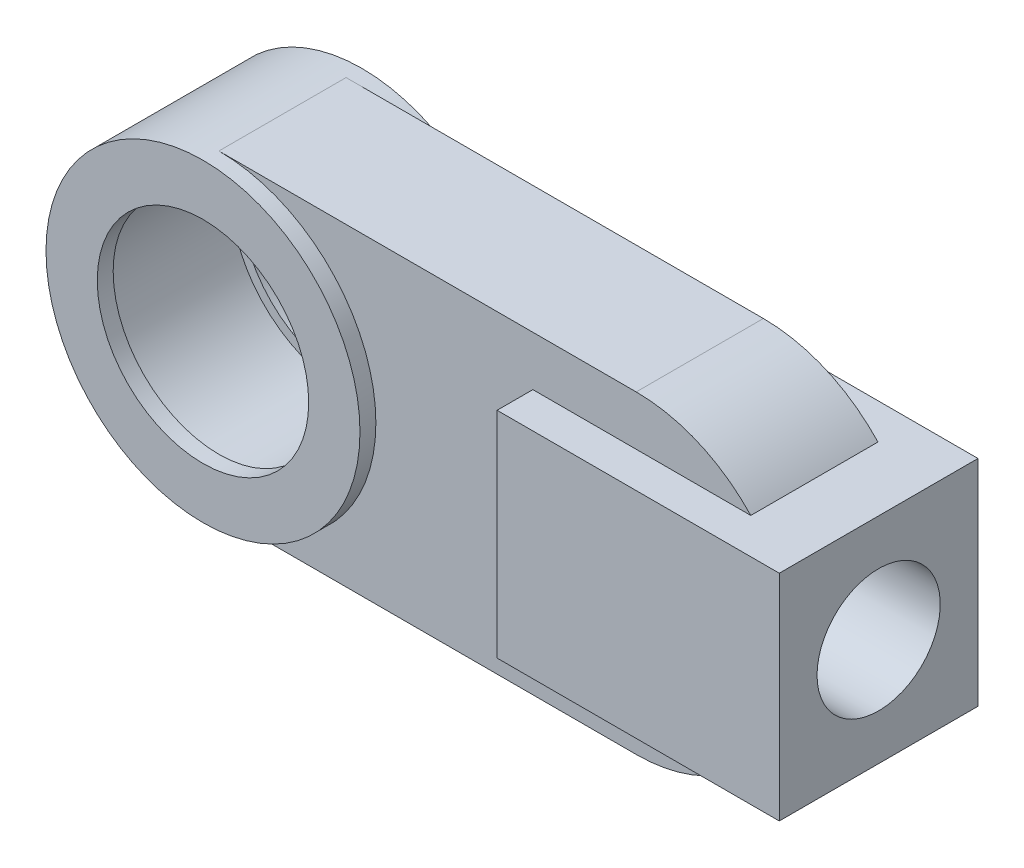
from build123d import *

# Parameters (mm, degrees)
F_01_START                              = -1.6
F_01_SOCKET_HEAD_AND_SHANK_DEPTH        = 3.2
F_02_START                              = -2
S02_ARTICULATION_OPENING_R              = 2.9
F_02_ARTICULATION_OPENING_DEPTH         = 4
F_03_START                              = -2
S03_CAPTIVE_SPHERICAL_SEAT_LIP_1_R      = 3.95
S03_CAPTIVE_SPHERICAL_SEAT_LIP_1_R_2    = 2.66
F_03_CAPTIVE_SPHERICAL_SEAT_LIP_1_DEPTH = 0.4
F_04_START                              = 1.6
S04_CAPTIVE_SPHERICAL_SEAT_LIP_2_R      = 3.95
S04_CAPTIVE_SPHERICAL_SEAT_LIP_2_R_2    = 2.66
F_04_CAPTIVE_SPHERICAL_SEAT_LIP_2_DEPTH = 0.4
F_05_START                              = -2.5
S05_ROD_THREAD_BOSS_W                   = 7.1
S05_ROD_THREAD_BOSS_H                   = 5.4
F_05_ROD_THREAD_BOSS_DEPTH              = 5
F_06_START                              = 7
S06_M3_INTERNAL_THREAD_ENVELOPE_R       = 1.55
F_06_M3_INTERNAL_THREAD_ENVELOPE_DEPTH  = 9


with BuildPart() as part:
    # S01 - Socket head and shank → 01 - Socket head and shank (new body)
    with BuildSketch(Plane.XY.offset(F_01_START)):
        with BuildLine():
            Line((0, 3.95), (10.5, 3.95))
            ThreePointArc((10.5, 3.95), (14.45, 0), (10.5, -3.95))
            Line((10.5, -3.95), (0, -3.95))
            ThreePointArc((0, -3.95), (-3.95, 0), (0, 3.95))
        make_face()
    extrude(amount=F_01_SOCKET_HEAD_AND_SHANK_DEPTH)

    # S02 - Articulation opening → 02 - Articulation opening (cut)
    with BuildSketch(Plane.XY.offset(F_02_START)):
        Circle(S02_ARTICULATION_OPENING_R)
    extrude(amount=F_02_ARTICULATION_OPENING_DEPTH, mode=Mode.SUBTRACT)

    # S03 - Captive spherical seat lip 1 → 03 - Captive spherical seat lip 1 (add)
    with BuildSketch(Plane.XY.offset(F_03_START)):
        Circle(S03_CAPTIVE_SPHERICAL_SEAT_LIP_1_R)
        Circle(S03_CAPTIVE_SPHERICAL_SEAT_LIP_1_R_2, mode=Mode.SUBTRACT)
    extrude(amount=F_03_CAPTIVE_SPHERICAL_SEAT_LIP_1_DEPTH)

    # S04 - Captive spherical seat lip 2 → 04 - Captive spherical seat lip 2 (add)
    with BuildSketch(Plane.XY.offset(F_04_START)):
        Circle(S04_CAPTIVE_SPHERICAL_SEAT_LIP_2_R)
        Circle(S04_CAPTIVE_SPHERICAL_SEAT_LIP_2_R_2, mode=Mode.SUBTRACT)
    extrude(amount=F_04_CAPTIVE_SPHERICAL_SEAT_LIP_2_DEPTH)

    # S05 - Rod thread boss → 05 - Rod thread boss (add)
    with BuildSketch(Plane.XY.offset(F_05_START)):
        with Locations((11.45, 0)):
            Rectangle(S05_ROD_THREAD_BOSS_W, S05_ROD_THREAD_BOSS_H)
    extrude(amount=F_05_ROD_THREAD_BOSS_DEPTH)

    # S06 - M3 internal thread envelope → 06 - M3 internal thread envelope (cut)
    with BuildSketch(Plane(origin=(0, 0, 0), x_dir=(0, 0, -1), z_dir=(1, 0, 0)).offset(F_06_START)):
        Circle(S06_M3_INTERNAL_THREAD_ENVELOPE_R)
    extrude(amount=F_06_M3_INTERNAL_THREAD_ENVELOPE_DEPTH, mode=Mode.SUBTRACT)


solid = part.part
